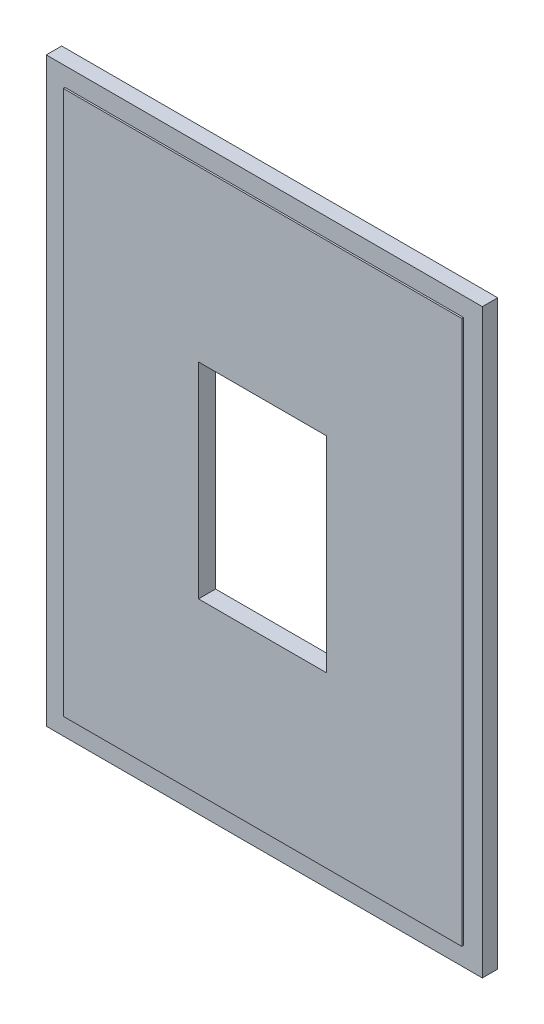
from build123d import *

# Parameters (mm, degrees)
ESQUISSE1_W             = 255
ESQUISSE1_H             = 340
BOSS_EXTRU_1_DEPTH      = 10
ESQUISSE2_W             = 255
ESQUISSE2_H             = 340
ESQUISSE2_W_2           = 233
ESQUISSE2_H_2           = 318
ENL_V_MAT_EXTRU_1_DEPTH = 1
SKETCH1_W               = 75
SKETCH1_H               = 120
CUT_EXTRUDE1_DEPTH      = 20


with BuildPart() as part:
    # Esquisse1 → Boss.-Extru.1 (new body)
    with BuildSketch(Plane.XY):
        Rectangle(ESQUISSE1_W, ESQUISSE1_H)
    extrude(amount=BOSS_EXTRU_1_DEPTH)

    # Esquisse2 → Enlèv. mat.-Extru.1 (cut)
    with BuildSketch(Plane.XY.offset(10)):
        Rectangle(ESQUISSE2_W, ESQUISSE2_H)
        Rectangle(ESQUISSE2_W_2, ESQUISSE2_H_2, mode=Mode.SUBTRACT)
    extrude(amount=-ENL_V_MAT_EXTRU_1_DEPTH, mode=Mode.SUBTRACT)

    # Sketch1 → Cut-Extrude1 (cut)
    with BuildSketch(Plane.XY.offset(10)):
        Rectangle(SKETCH1_W, SKETCH1_H)
    extrude(amount=-CUT_EXTRUDE1_DEPTH, mode=Mode.SUBTRACT)


solid = part.part
